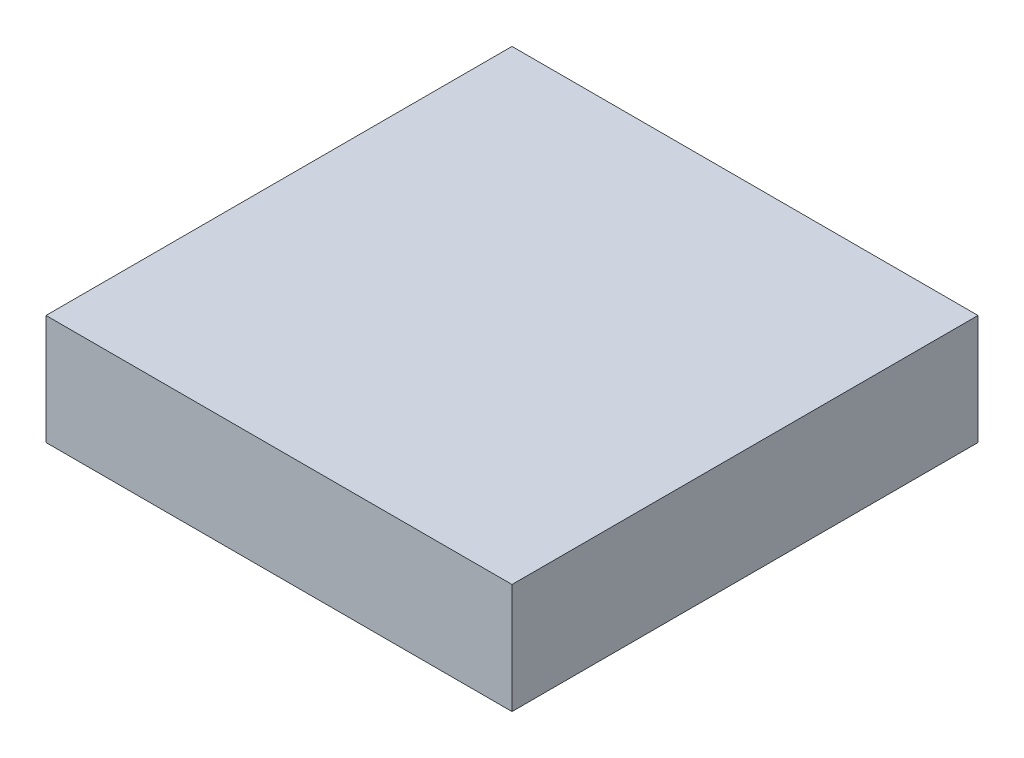
from build123d import *

# Parameters (mm, degrees)
CROQUIS1_W              = 12.7
CROQUIS1_H              = 12.7
SALIENTE_EXTRUIR1_DEPTH = 3


with BuildPart() as part:
    # Croquis1 → Saliente-Extruir1 (new body)
    with BuildSketch(Plane(origin=(0, 0, 0), x_dir=(1, 0, 0), z_dir=(0, 1, 0))):
        with Locations((6.35, 6.35)):
            Rectangle(CROQUIS1_W, CROQUIS1_H)
    extrude(amount=SALIENTE_EXTRUIR1_DEPTH)


solid = part.part
